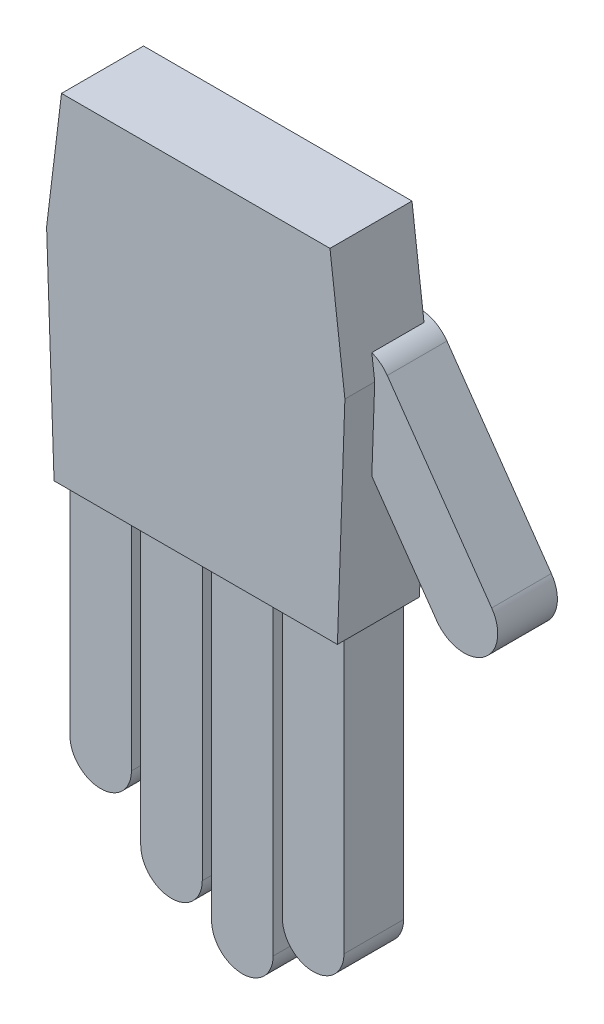
from build123d import *

# Parameters (mm, degrees)
PALMA_DEPTH   = 22
MENIQUE_DEPTH = 16
ANULAR_DEPTH  = 16
MEDIO_DEPTH   = 16
INDICE_DEPTH  = 16
PULGAR_DEPTH  = 16


with BuildPart() as part:
    # Sketch1 → Palma (new body)
    with BuildSketch(Plane.XY.offset(-11)):
        Polygon((-36, -27), (36, -27), (40, -60), (38, -118), (-38, -118), (-40, -60), align=None)
    extrude(amount=PALMA_DEPTH)

    # Sketch2 → Menique (add)
    with BuildSketch(Plane.XY.offset(-8)):
        with BuildLine():
            Line((-20.25, -112), (-20.25, -178))
            ThreePointArc((-20.25, -178), (-28.5, -186.25), (-36.75, -178))
            Line((-36.75, -178), (-36.75, -112))
            ThreePointArc((-36.75, -112), (-28.5, -103.75), (-20.25, -112))
        make_face()
    extrude(amount=MENIQUE_DEPTH)

    # Sketch3 → Anular (add)
    with BuildSketch(Plane.XY.offset(-8)):
        with BuildLine():
            Line((-1.25, -112), (-1.25, -194))
            ThreePointArc((-1.25, -194), (-9.5, -202.25), (-17.75, -194))
            Line((-17.75, -194), (-17.75, -112))
            ThreePointArc((-17.75, -112), (-9.5, -103.75), (-1.25, -112))
        make_face()
    extrude(amount=ANULAR_DEPTH)

    # Sketch4 → Medio (add)
    with BuildSketch(Plane.XY.offset(-8)):
        with BuildLine():
            Line((17.75, -112), (17.75, -202))
            ThreePointArc((17.75, -202), (9.5, -210.25), (1.25, -202))
            Line((1.25, -202), (1.25, -112))
            ThreePointArc((1.25, -112), (9.5, -103.75), (17.75, -112))
        make_face()
    extrude(amount=MEDIO_DEPTH)

    # Sketch5 → Indice (add)
    with BuildSketch(Plane.XY.offset(-8)):
        with BuildLine():
            Line((36.75, -112), (36.75, -192))
            ThreePointArc((36.75, -192), (28.5, -200.25), (20.25, -192))
            Line((20.25, -192), (20.25, -112))
            ThreePointArc((20.25, -112), (28.5, -103.75), (36.75, -112))
        make_face()
    extrude(amount=INDICE_DEPTH)

    # Sketch6 → Pulgar (add)
    with BuildSketch(Plane.XY.offset(-13)):
        with BuildLine():
            Line((43.373087285, -56.838838901), (71.373087285, -96.838838901))
            ThreePointArc((71.373087285, -96.838838901), (69.161161099, -109.373087285), (56.626912715, -107.161161099))
            Line((56.626912715, -107.161161099), (28.626912715, -67.161161099))
            ThreePointArc((28.626912715, -67.161161099), (30.838838901, -54.626912715), (43.373087285, -56.838838901))
        make_face()
    extrude(amount=PULGAR_DEPTH)


solid = part.part
